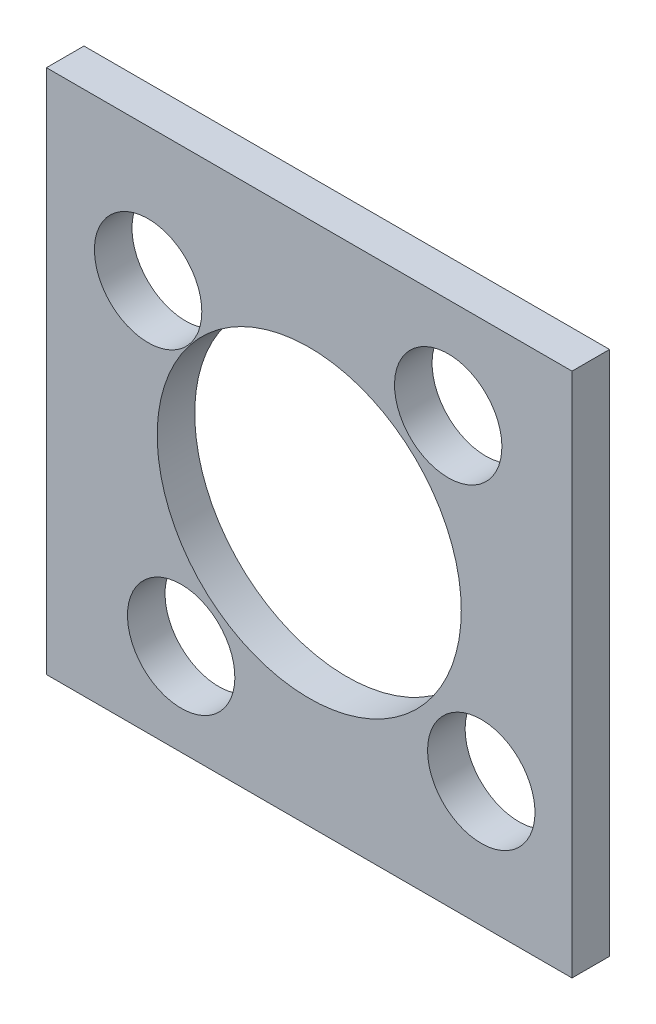
from build123d import *

# Parameters (mm, degrees)
SKETCH2_W           = 140
SKETCH2_H           = 140
BOSS_EXTRUDE1_DEPTH = 10
SKETCH3_R           = 14.3
CUT_EXTRUDE1_DEPTH  = 100.498743711
CIRPATTERN1_COUNT   = 4
SKETCH4_R           = 40.5
CUT_EXTRUDE2_DEPTH  = 100.498743711


with BuildPart() as part:
    # Sketch2 → Boss-Extrude1 (new body)
    with BuildSketch(Plane.XY):
        Rectangle(SKETCH2_W, SKETCH2_H)
    extrude(amount=BOSS_EXTRUDE1_DEPTH)

    # Sketch3 → Cut-Extrude1 (cut, through all)
    with BuildSketch(Plane.XY.offset(10)):
        with Locations((-42.915392768, 34.398678224)):
            Circle(SKETCH3_R)
    cut_extrude1 = extrude(amount=-CUT_EXTRUDE1_DEPTH, mode=Mode.SUBTRACT)

    # CirPattern1: Cut-Extrude1 ×4 about axis
    cirpattern1_axis = Axis((1.454294092, -1.165684182, 0), (0, 0, 1))
    for i in range(1, CIRPATTERN1_COUNT):
        add(cut_extrude1.rotate(cirpattern1_axis, i * 360 / CIRPATTERN1_COUNT), mode=Mode.SUBTRACT)

    # Sketch4 → Cut-Extrude2 (cut, through all)
    with BuildSketch(Plane.XY.offset(10)):
        Circle(SKETCH4_R)
    extrude(amount=-CUT_EXTRUDE2_DEPTH, mode=Mode.SUBTRACT)


solid = part.part
